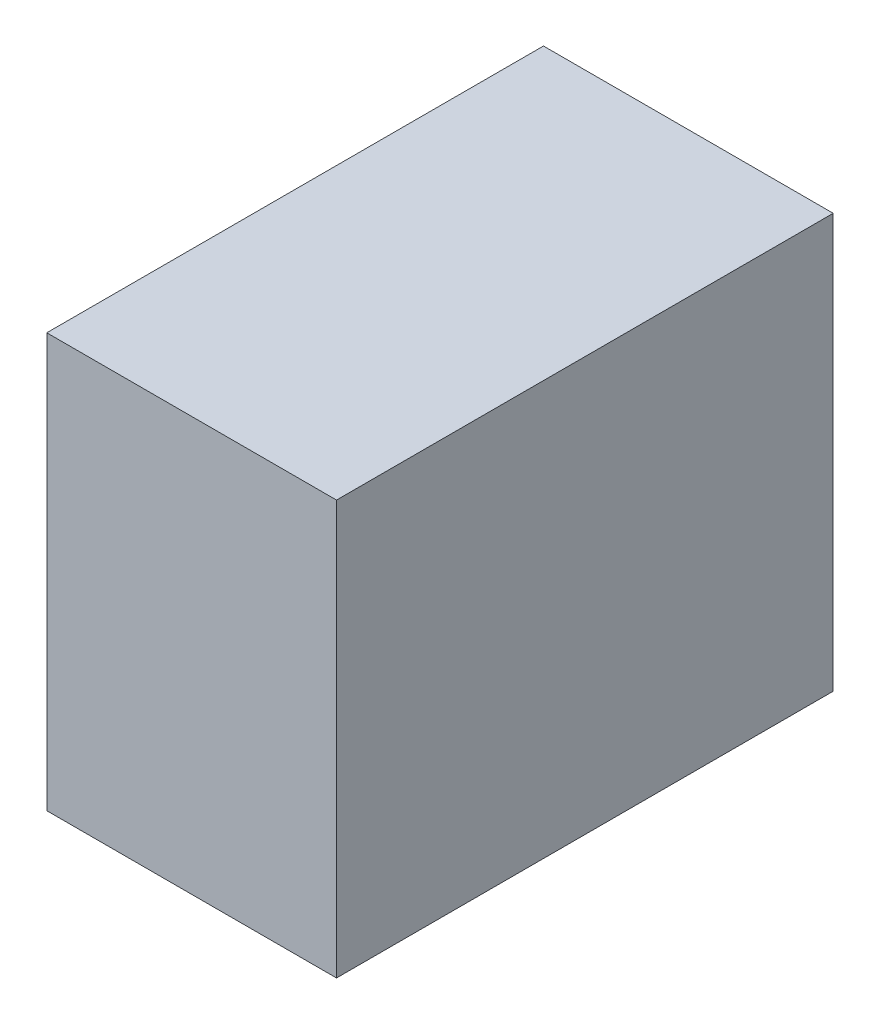
from build123d import *

# Parameters (mm, degrees)
SKETCH1_W           = 177.8
SKETCH1_H           = 254
BOSS_EXTRUDE1_DEPTH = 304.8


with BuildPart() as part:
    # Sketch1 → Boss-Extrude1 (new body)
    with BuildSketch(Plane.XY):
        Rectangle(SKETCH1_W, SKETCH1_H)
    extrude(amount=BOSS_EXTRUDE1_DEPTH)


solid = part.part
